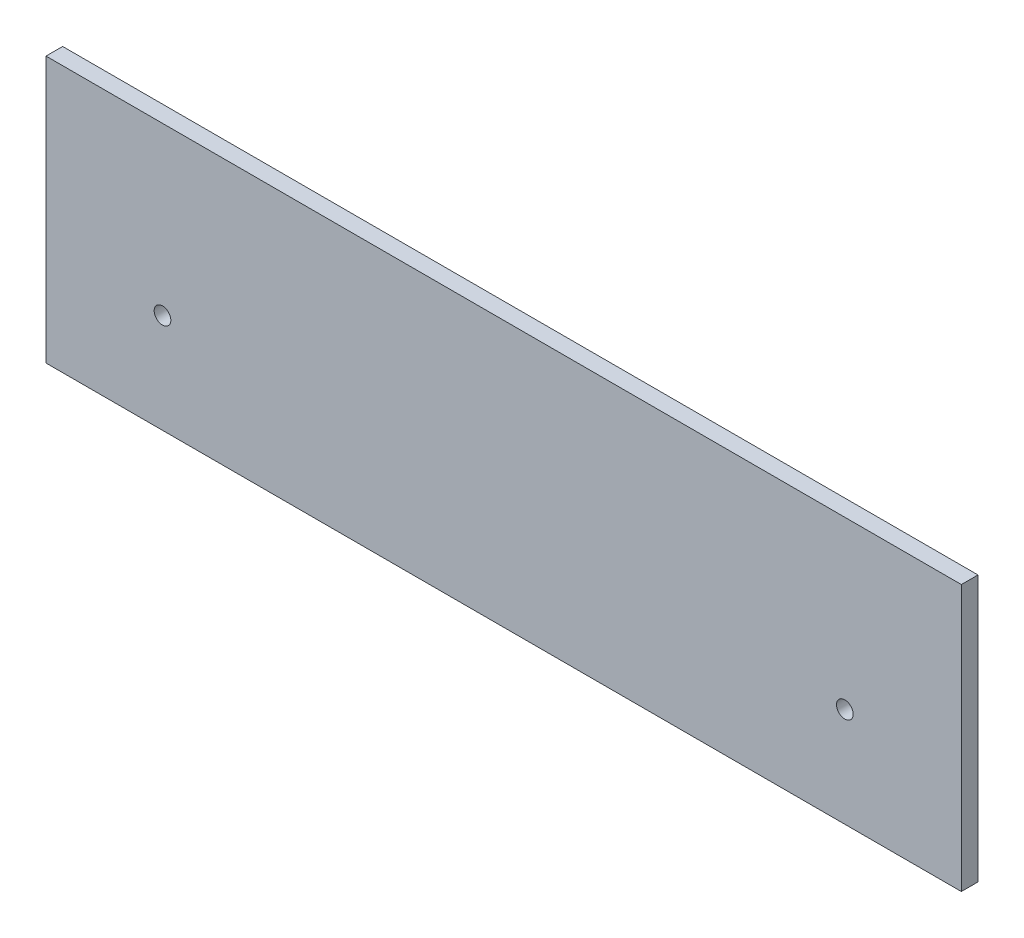
from build123d import *

# Parameters (mm, degrees)
SKETCH1_W           = 55
SKETCH1_H           = 20
BOSS_EXTRUDE1_DEPTH = 1
SKETCH2_R           = 0.5
CUT_EXTRUDE1_DEPTH  = 59.532042507
SKETCH4_W           = 55
SKETCH4_H           = 4.024392025
CUT_EXTRUDE3_DEPTH  = 5


with BuildPart() as part:
    # Sketch1 → Boss-Extrude1 (new body)
    with BuildSketch(Plane.XY):
        with Locations((27.5, -10)):
            Rectangle(SKETCH1_W, SKETCH1_H)
    extrude(amount=BOSS_EXTRUDE1_DEPTH)

    # Sketch2 → Cut-Extrude1 (cut, through all)
    with BuildSketch(Plane.XY.offset(1)):
        with Locations((7, -10)):
            Circle(SKETCH2_R)
    cut_extrude1 = extrude(amount=-CUT_EXTRUDE1_DEPTH, mode=Mode.SUBTRACT)

    # Mirror2: Cut-Extrude1 across plane
    add(cut_extrude1.mirror(Plane.ZY.offset(-27.5)), mode=Mode.SUBTRACT)

    # Sketch4 → Cut-Extrude3 (cut)
    with BuildSketch(Plane.XY.offset(1)):
        with Locations((27.5, -17.987803988)):
            Rectangle(SKETCH4_W, SKETCH4_H)
    extrude(amount=-CUT_EXTRUDE3_DEPTH, mode=Mode.SUBTRACT)


solid = part.part
